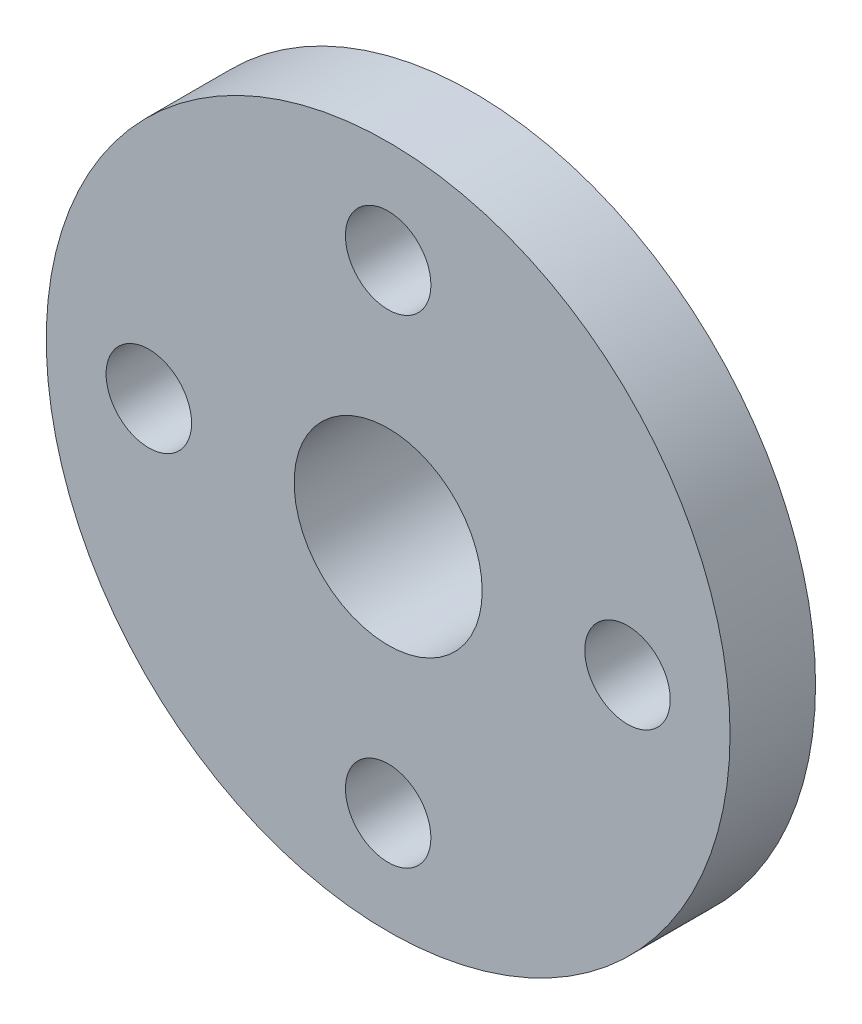
from build123d import *

# Parameters (mm, degrees)
SPLINE_HUB_ENVELOPE_START             = 12.2
SPLINE_HUB_ENVELOPE_PROFILE_R         = 5.5
SPLINE_HUB_ENVELOPE_PROFILE_R_2       = 2.75
SPLINE_HUB_ENVELOPE_DEPTH             = 2
DISC_D20_PCD14_TAP_DRILLS_START       = 14.2
DISC_D20_PCD14_TAP_DRILLS_PROFILE_R   = 10
DISC_D20_PCD14_TAP_DRILLS_PROFILE_R_2 = 2.75
DISC_D20_PCD14_TAP_DRILLS_PROFILE_R_3 = 1.25
DISC_D20_PCD14_TAP_DRILLS_DEPTH       = 2.5


with BuildPart() as part:
    # Spline_hub_envelope_Profile → Spline_hub_envelope (new body)
    with BuildSketch(Plane.XY.offset(SPLINE_HUB_ENVELOPE_START)):
        with Locations((12.5, 0)):
            Circle(SPLINE_HUB_ENVELOPE_PROFILE_R)
        with Locations((12.5, 0)):
            Circle(SPLINE_HUB_ENVELOPE_PROFILE_R_2, mode=Mode.SUBTRACT)
    extrude(amount=SPLINE_HUB_ENVELOPE_DEPTH)

    # Disc_D20_PCD14_tap_drills_Profile → Disc_D20_PCD14_tap_drills (add)
    with BuildSketch(Plane.XY.offset(DISC_D20_PCD14_TAP_DRILLS_START)):
        with Locations((12.5, 0)):
            Circle(DISC_D20_PCD14_TAP_DRILLS_PROFILE_R)
        with Locations((12.5, 0)):
            Circle(DISC_D20_PCD14_TAP_DRILLS_PROFILE_R_2, mode=Mode.SUBTRACT)
        with Locations((19.5, 0)):
            Circle(DISC_D20_PCD14_TAP_DRILLS_PROFILE_R_3, mode=Mode.SUBTRACT)
        with Locations((5.5, 0)):
            Circle(DISC_D20_PCD14_TAP_DRILLS_PROFILE_R_3, mode=Mode.SUBTRACT)
        with Locations((12.5, 7)):
            Circle(DISC_D20_PCD14_TAP_DRILLS_PROFILE_R_3, mode=Mode.SUBTRACT)
        with Locations((12.5, -7)):
            Circle(DISC_D20_PCD14_TAP_DRILLS_PROFILE_R_3, mode=Mode.SUBTRACT)
    extrude(amount=DISC_D20_PCD14_TAP_DRILLS_DEPTH)


solid = part.part
